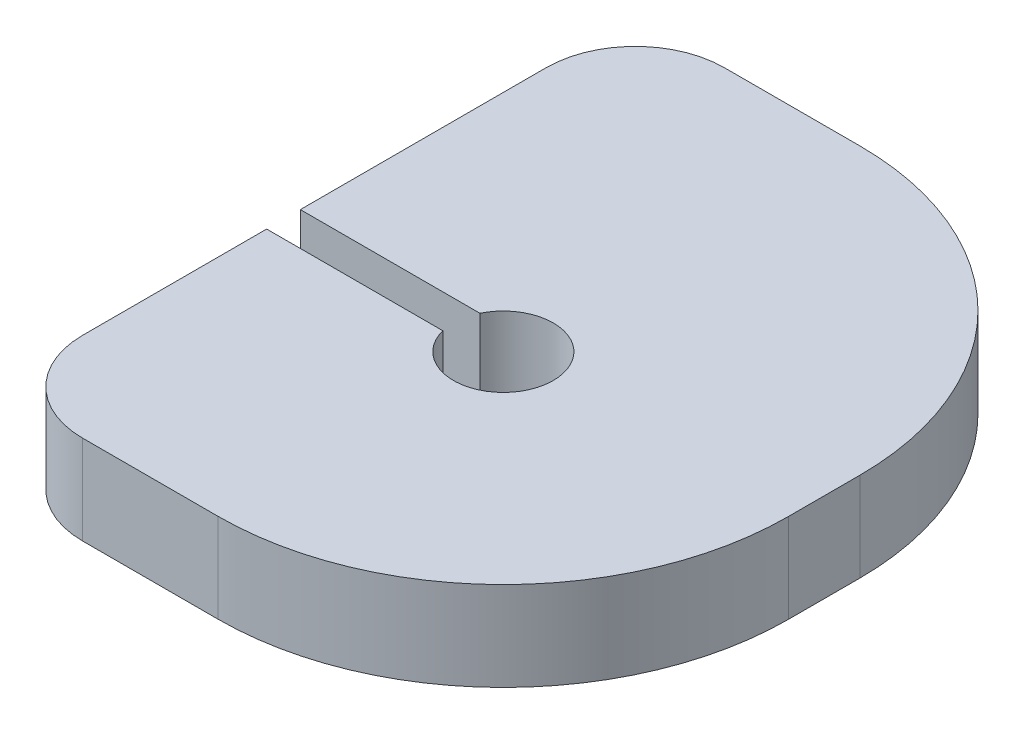
from build123d import *

# Parameters (mm, degrees)
SKETCH1_W           = 50.8
SKETCH1_H           = 22.86
BOSS_EXTRUDE1_DEPTH = 3.175
FILLET1_R           = 10.16
SKETCH3_R           = 1.778
CUT_EXTRUDE1_DEPTH  = 29.033649869
FILLET3_R           = 10.16
SKETCH4_W           = 32.639
SKETCH4_H           = 22.86
CUT_EXTRUDE2_DEPTH  = 29.033649869
FILLET9_R           = 3.175
SKETCH5_W           = 6.800031064
SKETCH5_H           = 1.2
CUT_EXTRUDE4_DEPTH  = 29.033649869


with BuildPart() as part:
    # Sketch1 → Boss-Extrude1 (new body)
    with BuildSketch(Plane(origin=(0, 0, 0), x_dir=(1, 0, 0), z_dir=(0, 1, 0))):
        Rectangle(SKETCH1_W, SKETCH1_H)
    extrude(amount=BOSS_EXTRUDE1_DEPTH)

    # Fillet1
    fillet1_edges = [part.edges().sort_by_distance(p)[0] for p in [
        (25.4, 1.5875, 11.43),
        (-25.4, 1.5875, 11.43),
    ]]
    fillet(fillet1_edges, radius=FILLET1_R)

    # Sketch3 → Cut-Extrude1 (cut, through all)
    with BuildSketch(Plane(origin=(0, 3.175, 0), x_dir=(1, 0, 0), z_dir=(0, 1, 0))):
        with Locations(Location((15.24, -1.27, 0), (0, 0, 270))):
            Circle(SKETCH3_R)
        with Locations(Location((-3.81, -1.27, 0), (0, 0, 270))):
            Circle(SKETCH3_R)
    extrude(amount=-CUT_EXTRUDE1_DEPTH, mode=Mode.SUBTRACT)

    # Fillet3
    fillet3_edges = [part.edges().sort_by_distance(p)[0] for p in [
        (-25.4, 1.5875, -11.43),
        (25.4, 1.5875, -11.43),
    ]]
    fillet(fillet3_edges, radius=FILLET3_R)

    # Sketch4 → Cut-Extrude2 (cut, through all)
    with BuildSketch(Plane(origin=(0, 3.175, 0), x_dir=(1, 0, 0), z_dir=(0, 1, 0))):
        with Locations((-9.0805, 0)):
            Rectangle(SKETCH4_W, SKETCH4_H)
    extrude(amount=-CUT_EXTRUDE2_DEPTH, mode=Mode.SUBTRACT)

    # Fillet9
    fillet9_edges = [part.edges().sort_by_distance(p)[0] for p in [
        (7.239, 1.5875, -11.43),
        (7.239, 1.5875, 11.43),
    ]]
    fillet(fillet9_edges, radius=FILLET9_R)

    # Sketch5 → Cut-Extrude4 (cut, through all)
    with BuildSketch(Plane(origin=(0, 3.175, 0), x_dir=(1, 0, 0), z_dir=(0, 1, 0))):
        with Locations((10.639015532, -1.100889409)):
            Rectangle(SKETCH5_W, SKETCH5_H)
    extrude(amount=-CUT_EXTRUDE4_DEPTH, mode=Mode.SUBTRACT)


solid = part.part
